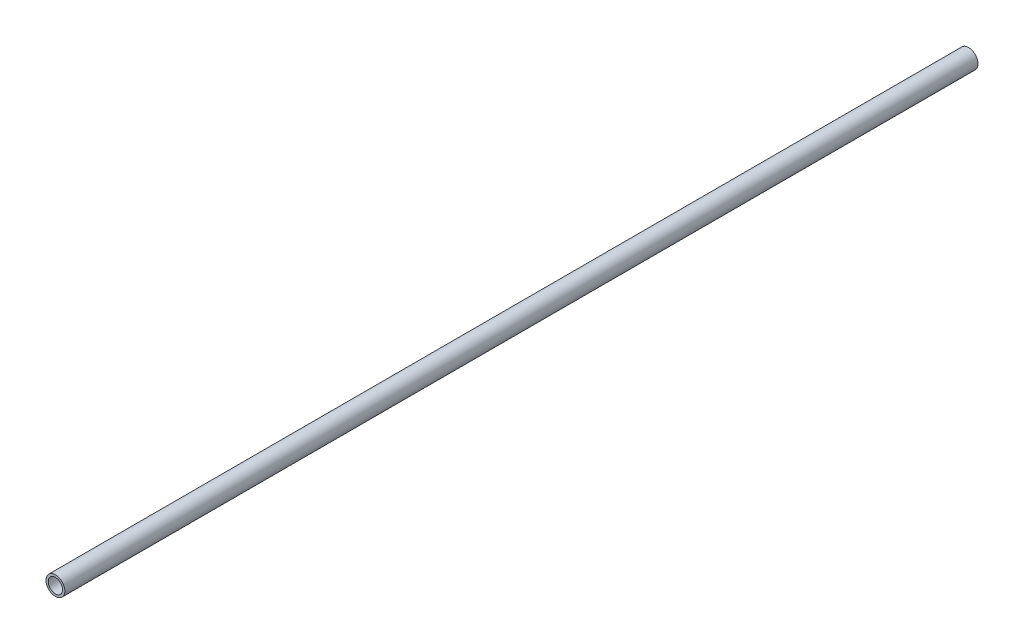
from build123d import *

# Parameters (mm, degrees)
SKETCH1_R           = 16.7005
SKETCH1_R_2         = 12.7
BOSS_EXTRUDE1_DEPTH = 1618.996


with BuildPart() as part:
    # Sketch1 → Boss-Extrude1 (new body)
    with BuildSketch(Plane.XY):
        Circle(SKETCH1_R)
        Circle(SKETCH1_R_2, mode=Mode.SUBTRACT)
    extrude(amount=BOSS_EXTRUDE1_DEPTH)


solid = part.part
